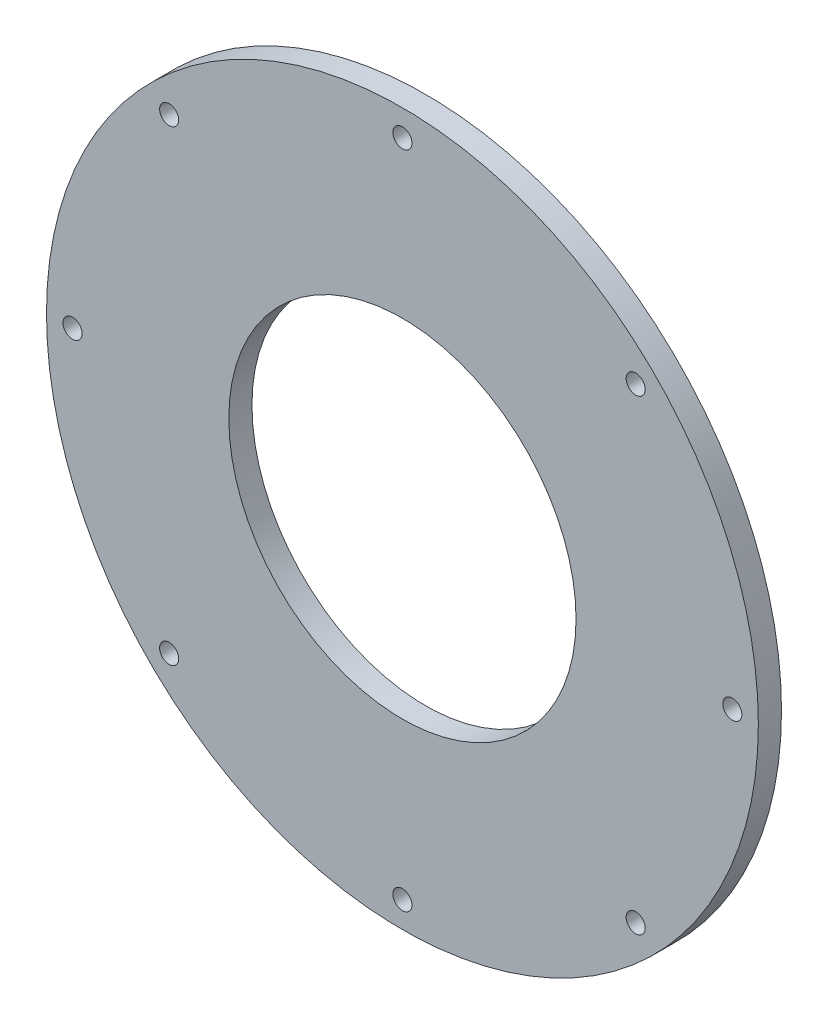
from build123d import *

# Parameters (mm, degrees)
SKETCH_1_R          = 61.5
SKETCH_1_R_2        = 1.65
SKETCH_1_R_3        = 2.6
SKETCH_1_R_4        = 15.5
EXTRUDE_1_DEPTH     = 4
SKETCH_2_R          = 30
CUT_EXTRUDE_1_DEPTH = 10


with BuildPart() as part:
    # 草图1 → 凸台-拉伸1 (new body)
    with BuildSketch(Plane.XY):
        Circle(SKETCH_1_R)
        with Locations((0, -57)):
            Circle(SKETCH_1_R_2, mode=Mode.SUBTRACT)
        with Locations((-40.305086528, -40.305086528)):
            Circle(SKETCH_1_R_2, mode=Mode.SUBTRACT)
        with Locations((-57, 0)):
            Circle(SKETCH_1_R_2, mode=Mode.SUBTRACT)
        with Locations((-40.305086528, 40.305086528)):
            Circle(SKETCH_1_R_2, mode=Mode.SUBTRACT)
        with Locations((0, -23.75)):
            Circle(SKETCH_1_R_3, mode=Mode.SUBTRACT)
        with Locations((-20.56810334, 11.875)):
            Circle(SKETCH_1_R_3, mode=Mode.SUBTRACT)
        with Locations((20.56810334, 11.875)):
            Circle(SKETCH_1_R_3, mode=Mode.SUBTRACT)
        with Locations((19.485571585, -11.25)):
            Circle(SKETCH_1_R_3, mode=Mode.SUBTRACT)
        with Locations((-19.485571585, -11.25)):
            Circle(SKETCH_1_R_3, mode=Mode.SUBTRACT)
        with Locations((0, 22.5)):
            Circle(SKETCH_1_R_3, mode=Mode.SUBTRACT)
        Circle(SKETCH_1_R_4, mode=Mode.SUBTRACT)
        with Locations((0, 57)):
            Circle(SKETCH_1_R_2, mode=Mode.SUBTRACT)
        with Locations((40.305086528, 40.305086528)):
            Circle(SKETCH_1_R_2, mode=Mode.SUBTRACT)
        with Locations((57, 0)):
            Circle(SKETCH_1_R_2, mode=Mode.SUBTRACT)
        with Locations((40.305086528, -40.305086528)):
            Circle(SKETCH_1_R_2, mode=Mode.SUBTRACT)
    extrude(amount=EXTRUDE_1_DEPTH)

    # 草图2 → 切除-拉伸1 (cut)
    with BuildSketch(Plane.XY.offset(4)):
        Circle(SKETCH_2_R)
    extrude(amount=-CUT_EXTRUDE_1_DEPTH, mode=Mode.SUBTRACT)


solid = part.part
